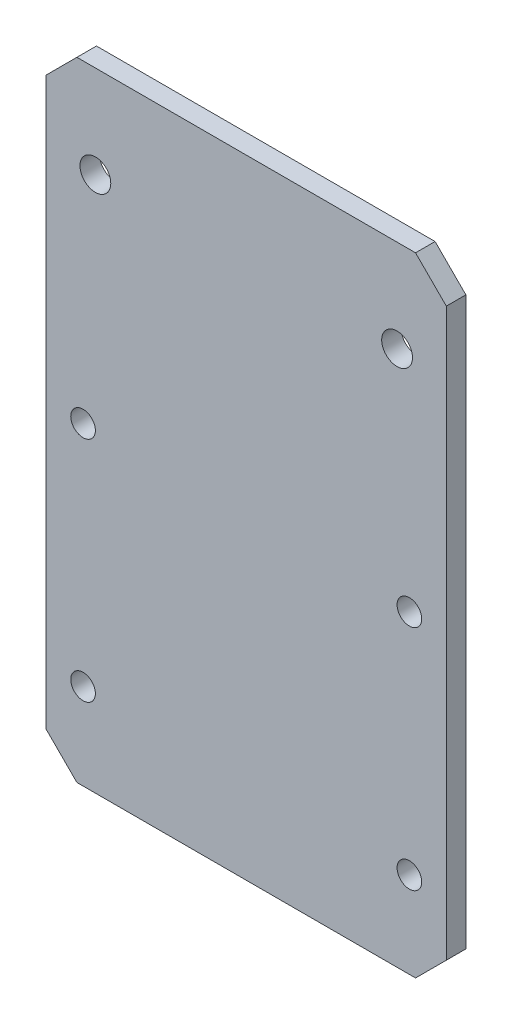
from build123d import *

# Parameters (mm, degrees)
SKETCH1_W           = 65
SKETCH1_H           = 102
SKETCH1_R           = 2.5
SKETCH1_R_2         = 2
BOSS_EXTRUDE1_DEPTH = 3.175
CHAMFER1_SIZE       = 5


with BuildPart() as part:
    # Sketch1 → Boss-Extrude1 (new body)
    with BuildSketch(Plane.XY):
        Rectangle(SKETCH1_W, SKETCH1_H)
        with Locations((24.5, 36)):
            Circle(SKETCH1_R, mode=Mode.SUBTRACT)
        with Locations((-24.5, 36)):
            Circle(SKETCH1_R, mode=Mode.SUBTRACT)
        with Locations((26.5, 0)):
            Circle(SKETCH1_R_2, mode=Mode.SUBTRACT)
        with Locations(Location((-26.5, 0, 0), (0, 0, 180))):
            Circle(SKETCH1_R_2, mode=Mode.SUBTRACT)
        with Locations((-26.5, -37)):
            Circle(SKETCH1_R_2, mode=Mode.SUBTRACT)
        with Locations(Location((26.5, -37, 0), (0, 0, 180))):
            Circle(SKETCH1_R_2, mode=Mode.SUBTRACT)
    extrude(amount=BOSS_EXTRUDE1_DEPTH)

    # Chamfer1
    chamfer1_edges = [part.edges().sort_by_distance(p)[0] for p in [
        (32.5, -51, 1.5875),
        (-32.5, -51, 1.5875),
        (-32.5, 51, 1.5875),
        (32.5, 51, 1.5875),
    ]]
    chamfer(chamfer1_edges, length=CHAMFER1_SIZE)


solid = part.part
